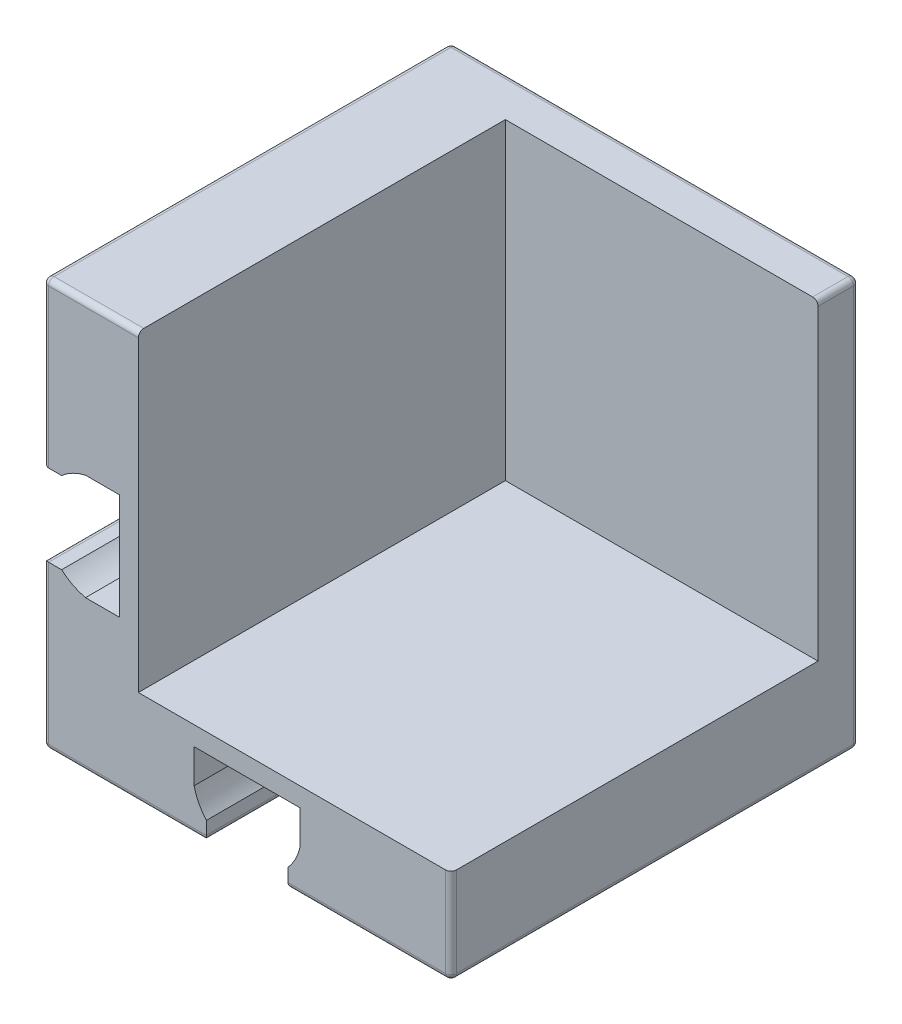
from build123d import *

# Parameters (mm, degrees)
SKETCH_1_W           = 15
SKETCH_1_H           = 15
EXTRUDE_1_DEPTH      = 15
SKETCH_2_W           = 11.5
SKETCH_2_H           = 13.5
CUT_EXTRUDE_1_DEPTH  = 11.5
CUT_EXTRUDE_2_DEPTH  = 9.45
SKETCH_4_W           = 3
SKETCH_4_H           = 3
EXTRUDE_2_DEPTH      = 1
EXTRUDE_3_DEPTH      = 2
EXTRUDE_3_DEPTH_BACK = 4
CUT_EXTRUDE_3_REACH  = 26.911
SKETCH_6_W           = 0.944409721
SKETCH_6_H           = 0.55
SKETCH_6_H_2         = 1.55
FILLET_1_R           = 0.1
FILLET_2_R           = 0.2


with BuildPart() as part:
    # 草图1 → 凸台-拉伸1 (new body)
    with BuildSketch(Plane.XY):
        with Locations((0, 7.5)):
            Rectangle(SKETCH_1_W, SKETCH_1_H)
    extrude(amount=-EXTRUDE_1_DEPTH)

    # 草图2 → 切除-拉伸1 (cut)
    with BuildSketch(Plane(origin=(0, 15, 0), x_dir=(-1, 0, 0), z_dir=(0, 1, 0))):
        with Locations((-1.75, -6.75)):
            Rectangle(SKETCH_2_W, SKETCH_2_H)
    extrude(amount=-CUT_EXTRUDE_1_DEPTH, mode=Mode.SUBTRACT)

    # 草图3 → 切除-拉伸2 (cut)
    with BuildSketch(Plane.XY):
        with BuildLine():
            Line((-1.5, 0), (-1.5, 0.677124344))
            ThreePointArc((-1.5, 0.677124344), (-1.780042303, 1.088161527), (-1.95, 1.555590279))
            Line((-1.95, 1.555590279), (-1.95, 2.8))
            Line((-1.95, 2.8), (1.95, 2.8))
            Line((1.95, 2.8), (1.95, 1.555590279))
            ThreePointArc((1.95, 1.555590279), (1.780042303, 1.088161527), (1.5, 0.677124344))
            Line((1.5, 0.677124344), (1.5, 0))
            Line((1.5, 0), (-1.5, 0))
        make_face()
        with BuildLine():
            Line((-7.5, 9), (-7.5, 6))
            Line((-7.5, 6), (-6.822875656, 6))
            ThreePointArc((-6.822875656, 6), (-6.411838473, 5.719957697), (-5.944409721, 5.55))
            Line((-5.944409721, 5.55), (-4.7, 5.55))
            Line((-4.7, 5.55), (-4.7, 9.45))
            Line((-4.7, 9.45), (-5.944409721, 9.45))
            ThreePointArc((-5.944409721, 9.45), (-6.411838473, 9.280042303), (-6.822875656, 9))
            Line((-6.822875656, 9), (-7.5, 9))
        make_face()
    extrude(amount=-CUT_EXTRUDE_2_DEPTH, mode=Mode.SUBTRACT)

    # 草图4 → 凸台-拉伸2 (add)
    with BuildSketch(Plane(origin=(0, 0, -15), x_dir=(-1, 0, 0), z_dir=(0, 0, -1))):
        with Locations((0, 7.5)):
            Rectangle(SKETCH_4_W, SKETCH_4_H)
    extrude(amount=EXTRUDE_2_DEPTH)

    # 草图5 → 凸台-拉伸3 (add, two sides: drawn at the far end of the back side and taken through both)
    with BuildSketch(Plane(origin=(0, 9, 0), x_dir=(-1, 0, 0), z_dir=(0, 1, 0)).offset(-EXTRUDE_3_DEPTH_BACK)):
        with BuildLine():
            Line((1.95, -17.5), (-1.95, -17.5))
            Line((-1.95, -17.5), (-1.95, -16.555590279))
            ThreePointArc((-1.95, -16.555590279), (-1.780042303, -16.088161527), (-1.5, -15.677124344))
            Line((-1.5, -15.677124344), (1.5, -15.677124344))
            ThreePointArc((1.5, -15.677124344), (1.780042303, -16.088161527), (1.95, -16.555590279))
            Line((1.95, -16.555590279), (1.95, -17.5))
        make_face()
    extrude(amount=EXTRUDE_3_DEPTH + EXTRUDE_3_DEPTH_BACK)

    # 草图6 → 切除-拉伸3 (cut, up to next)
    with BuildSketch(Plane(origin=(1.95, 0, 0), x_dir=(0, 0, -1), z_dir=(1, 0, 0)), mode=Mode.PRIVATE) as cut_extrude_3_sk1:
        with BuildLine():
            Line((16.555590279, 5), (16.555590279, 5.55))
            ThreePointArc((16.555590279, 5.55), (16.088161527, 5.719957697), (15.677124344, 6))
            Line((15.677124344, 6), (15.677124344, 5))
            Line((15.677124344, 5), (16.555590279, 5))
        make_face()
    cut_extrude_3_tool1 = extrude(cut_extrude_3_sk1.sketch, amount=-CUT_EXTRUDE_3_REACH, mode=Mode.PRIVATE) & part.part
    # 草图6 → 切除-拉伸3 (cut, up to next)
    with BuildSketch(Plane(origin=(1.95, 0, 0), x_dir=(0, 0, -1), z_dir=(1, 0, 0)), mode=Mode.PRIVATE) as cut_extrude_3_sk2:
        with Locations((17.02779514, 5.275)):
            Rectangle(SKETCH_6_W, SKETCH_6_H)
    cut_extrude_3_tool2 = extrude(cut_extrude_3_sk2.sketch, amount=-CUT_EXTRUDE_3_REACH, mode=Mode.PRIVATE) & part.part
    # 草图6 → 切除-拉伸3 (cut, up to next)
    with BuildSketch(Plane(origin=(1.95, 0, 0), x_dir=(0, 0, -1), z_dir=(1, 0, 0)), mode=Mode.PRIVATE) as cut_extrude_3_sk3:
        with Locations((17.02779514, 10.225)):
            Rectangle(SKETCH_6_W, SKETCH_6_H_2)
    cut_extrude_3_tool3 = extrude(cut_extrude_3_sk3.sketch, amount=-CUT_EXTRUDE_3_REACH, mode=Mode.PRIVATE) & part.part
    # 草图6 → 切除-拉伸3 (cut, up to next)
    with BuildSketch(Plane(origin=(1.95, 0, 0), x_dir=(0, 0, -1), z_dir=(1, 0, 0)), mode=Mode.PRIVATE) as cut_extrude_3_sk4:
        with BuildLine():
            ThreePointArc((15.677124344, 9), (16.088161527, 9.280042303), (16.555590279, 9.45))
            Line((16.555590279, 9.45), (16.555590279, 11))
            Line((16.555590279, 11), (15.677124344, 11))
            Line((15.677124344, 11), (15.677124344, 9))
        make_face()
    cut_extrude_3_tool4 = extrude(cut_extrude_3_sk4.sketch, amount=-CUT_EXTRUDE_3_REACH, mode=Mode.PRIVATE) & part.part
    add(cut_extrude_3_tool1.solids().sort_by_distance((1.95, 5.375771, -16.07186))[0], mode=Mode.SUBTRACT)
    add(cut_extrude_3_tool2.solids().sort_by_distance((1.95, 5.275, -17.027795))[0], mode=Mode.SUBTRACT)
    add(cut_extrude_3_tool3.solids().sort_by_distance((1.95, 10.225, -17.027795))[0], mode=Mode.SUBTRACT)
    add(cut_extrude_3_tool4.solids().sort_by_distance((1.95, 10.130885, -16.097603))[0], mode=Mode.SUBTRACT)

    # 圆角1
    fillet_1_edges = [part.edges().sort_by_distance(p)[0] for p in [
        (1.95, 7.5, -17.5),
        (-1.95, 7.5, -17.5),
        (0, 5.55, -17.5),
        (0, 9.45, -17.5),
    ]]
    fillet(fillet_1_edges, radius=FILLET_1_R)

    # 圆角2
    fillet_2_edges = [part.edges().sort_by_distance(p)[0] for p in [
        (7.5, 7.5, -15),
        (0, 15, -15),
        (-5.75, 15, 0),
        (4.5, 0, 0),
        (0, 0, -9.45),
        (1.5, 0, -4.725),
        (-1.5, 0, -4.725),
        (-7.5, 7.5, -15),
        (7.5, 1.75, 0),
        (-7.5, 3, 0),
        (-4.5, 0, 0),
        (-7.5, 7.5, -9.45),
        (-7.5, 6, -4.725),
        (-7.5, 9, -4.725),
        (-7.5, 12, 0),
        (0, 0, -15),
        (-7.5, 15, -7.5),
        (7.5, 15, -14.25),
        (7.5, 0, -7.5),
        (-7.5, 0, -7.5),
    ]]
    fillet(fillet_2_edges, radius=FILLET_2_R)


solid = part.part
